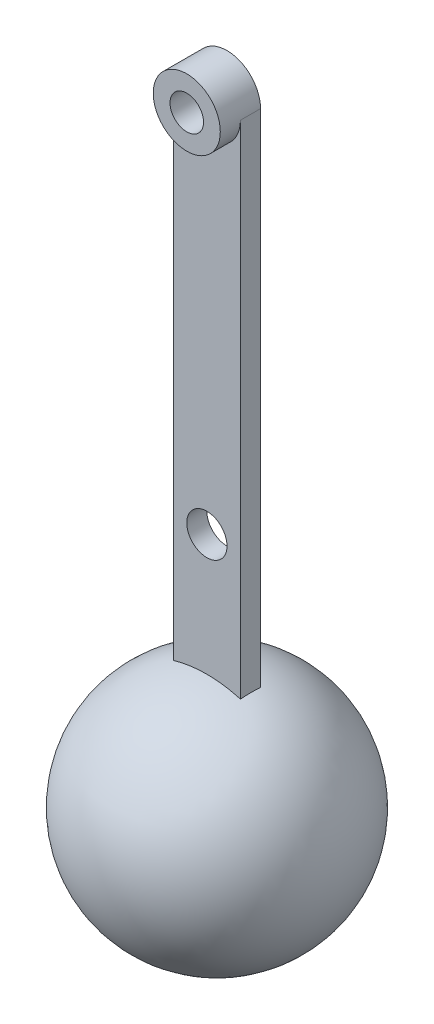
from build123d import *

# Parameters (mm, degrees)
SKETCH2_R                = 1.5
BOSS_EXTRUDE1_DEPTH      = 0.75
BOSS_EXTRUDE2_DEPTH      = 2.25
BOSS_EXTRUDE2_DEPTH_BACK = 0.75
SKETCH2_3_R              = 1.25


with BuildPart() as part:
    # Sketch1 → Revolve1 (revolve)
    with BuildSketch(Plane.XY):
        with BuildLine():
            Line((0, 9), (0, -9))
            ThreePointArc((0, -9), (-9, 0), (0, 9))
        make_face()
    revolve(axis=Axis((0, 9, 0), (0, -1, 0)))

    # Sketch2 → Boss-Extrude1 (add, symmetric)
    with BuildSketch(Plane.XY):
        with BuildLine():
            Line((2.5, 8.645808233), (2.5, 46))
            ThreePointArc((2.5, 46), (0, 43.5), (-2.5, 46))
            Line((-2.5, 46), (-2.5, 8.645808233))
            Line((-2.5, 8.645808233), (-2.5, 6.974093444))
            Line((-2.5, 6.974093444), (2.5, 6.974093444))
            Line((2.5, 6.974093444), (2.5, 8.645808233))
        make_face()
        with Locations((0, 18)):
            Circle(SKETCH2_R, mode=Mode.SUBTRACT)
    extrude(amount=BOSS_EXTRUDE1_DEPTH, both=True)

    # Sketch2<3> → Boss-Extrude2 (add, two sides: drawn at the far end of the back side and taken through both)
    with BuildSketch(Plane.XY.offset(-BOSS_EXTRUDE2_DEPTH_BACK)):
        with BuildLine():
            ThreePointArc((-2.5, 46), (0, 43.5), (2.5, 46))
            ThreePointArc((2.5, 46), (0, 48.5), (-2.5, 46))
        make_face()
        with Locations((0, 46)):
            Circle(SKETCH2_3_R, mode=Mode.SUBTRACT)
    extrude(amount=BOSS_EXTRUDE2_DEPTH + BOSS_EXTRUDE2_DEPTH_BACK)


solid = part.part
